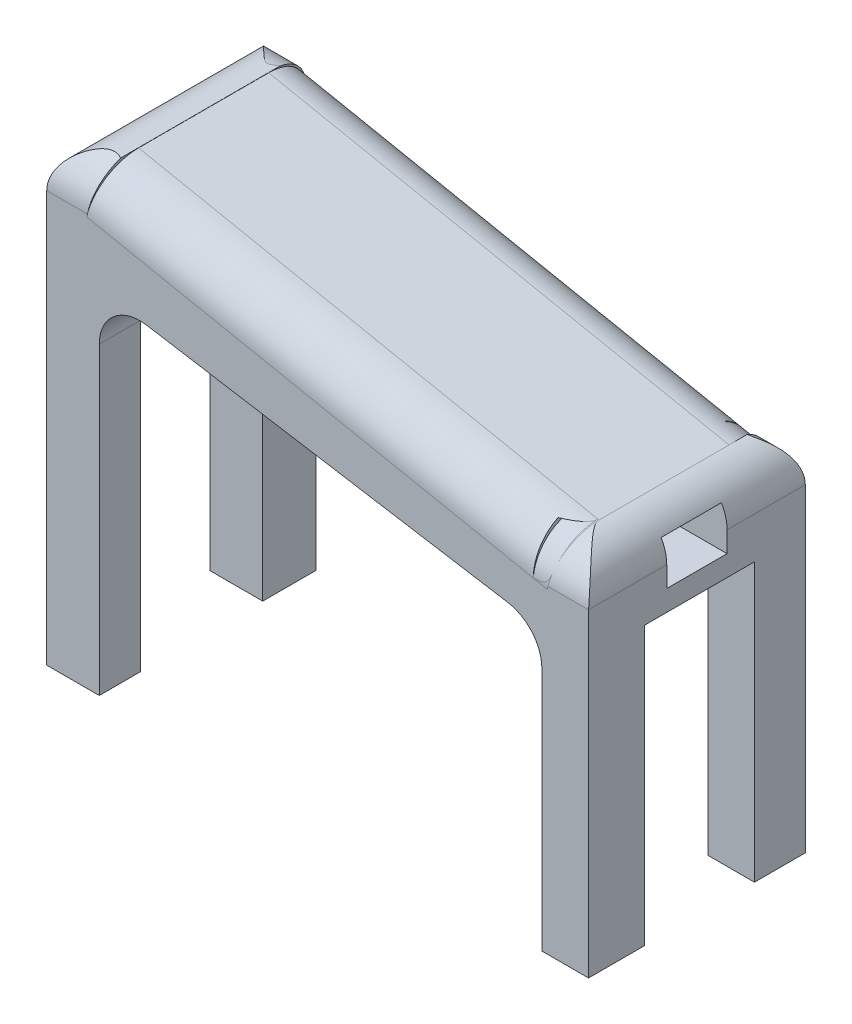
from build123d import *

# Parameters (mm, degrees)
SALIENTE_EXTRUIR1_DEPTH = 800
CROQUIS2_W              = 450.891954089
CROQUIS2_H              = 1153.204494417
CORTAR_EXTRUIR1_DEPTH   = 479
CROQUIS6_W              = 1733.666634621
CROQUIS6_H              = 800
CORTAR_EXTRUIR4_DEPTH   = 1
REDONDEO1_R             = 160
CORTAR_EXTRUIR5_DEPTH   = 204
CORTAR_EXTRUIR6_DEPTH   = 204
CROQUIS9_W              = 1543.706277585
CROQUIS9_H              = 195.894282261
CORTAR_EXTRUIR7_DEPTH   = 73
CROQUIS10_W             = 406.798125856
CROQUIS10_H             = 1024.288303457
CORTAR_EXTRUIR8_DEPTH   = 204
CROQUIS11_W             = 316.726975088
CROQUIS11_H             = 118.414803419
CORTAR_EXTRUIR9_DEPTH   = 204
CROQUIS13_W             = 222.696577042
CROQUIS13_H             = 152.562571667
CORTAR_EXTRUIR10_DEPTH  = 204


with BuildPart() as part:
    # Croquis1 → Saliente-Extruir1 (new body)
    with BuildSketch(Plane.XY):
        with BuildLine():
            Line((0, 0), (0, 1517.029414592))
            ThreePointArc((0, 1517.029414592), (54.901664159, 1633.030735793), (179.417420271, 1664.116515946))
            Line((179.417420271, 1664.116515946), (1879.417420271, 1324.116515946))
            ThreePointArc((1879.417420271, 1324.116515946), (1966.001321201, 1272.127750433), (2000, 1177.029414592))
            Line((2000, 1177.029414592), (2000, 0))
            Line((2000, 0), (1827.655470466, 0))
            Line((1827.655470466, 0), (1827.655470466, 903.590756555))
            ThreePointArc((1827.655470466, 903.590756555), (1792.016786618, 1000.655113392), (1702.035612225, 1051.596191212))
            Line((1702.035612225, 1051.596191212), (368.421499763, 1271.275294141))
            ThreePointArc((368.421499763, 1271.275294141), (246.977001167, 1237.631175636), (194.041358004, 1123.269859484))
            Line((194.041358004, 1123.269859484), (194.041358004, 0))
            Line((194.041358004, 0), (0, 0))
        make_face()
    extrude(amount=SALIENTE_EXTRUIR1_DEPTH)

    # Croquis2 → Cortar-Extruir1 (cut)
    with BuildSketch(Plane.ZY):
        with Locations((422.175014136, 576.602247208)):
            Rectangle(CROQUIS2_W, CROQUIS2_H)
    extrude(amount=-CORTAR_EXTRUIR1_DEPTH, mode=Mode.SUBTRACT)

    # Croquis6 → Cortar-Extruir4 (cut)
    with BuildSketch(Plane(origin=(326.923076923, 1634.615384615, 0), x_dir=(0.9805806756909202, -0.19611613513818404, 0), z_dir=(0.19611613513818404, 0.9805806756909202, 0))):
        with Locations((716.406472984, -400)):
            Rectangle(CROQUIS6_W, CROQUIS6_H)
    extrude(amount=-CORTAR_EXTRUIR4_DEPTH, mode=Mode.SUBTRACT)

    # Redondeo1
    redondeo1_edges = [part.edges().sort_by_distance(p)[0] for p in [
        (1029.221304136, 1493.13593527, 0),
        (1029.221304136, 1493.13593527, 800),
    ]]
    fillet(redondeo1_edges, radius=REDONDEO1_R)

    # Croquis7 → Cortar-Extruir5 (cut)
    with BuildSketch(Plane.ZY):
        with BuildLine():
            Line((0, 1517.029414592), (0, 1667.029414592))
            Line((0, 1667.029414592), (136.758196867, 1667.029414592))
            ThreePointArc((136.758196867, 1667.029414592), (39.321568117, 1618.521784269), (0, 1517.029414592))
        make_face()
        with BuildLine():
            ThreePointArc((800, 1517.029414592), (772.596251195, 1607.268062357), (699.64037564, 1667.029414592))
            Line((699.64037564, 1667.029414592), (800, 1667.029414592))
            Line((800, 1667.029414592), (800, 1517.029414592))
        make_face()
    extrude(amount=-CORTAR_EXTRUIR5_DEPTH, mode=Mode.SUBTRACT)

    # Croquis8 → Cortar-Extruir6 (cut)
    with BuildSketch(Plane(origin=(2000, 0, 0), x_dir=(0, 0, -1), z_dir=(1, 0, 0))):
        with BuildLine():
            ThreePointArc((-640, 1324.116515946), (-748.667630167, 1281.75735047), (-800, 1177.029414592))
            Line((-800, 1177.029414592), (-800, 1324.116515946))
            Line((-800, 1324.116515946), (-640, 1324.116515946))
        make_face()
        with BuildLine():
            ThreePointArc((0, 1177.029414592), (-25.457205923, 1264.264892498), (-93.837620587, 1324.116515946))
            Line((-93.837620587, 1324.116515946), (0, 1324.116515946))
            Line((0, 1324.116515946), (0, 1177.029414592))
        make_face()
    extrude(amount=-CORTAR_EXTRUIR6_DEPTH, mode=Mode.SUBTRACT)

    # Croquis9 → Cortar-Extruir7 (cut)
    with BuildSketch(Plane(origin=(297.309540517, 1486.547702586, 0), x_dir=(0.9805806756909202, -0.19611613513818407, 0), z_dir=(0.19611613513818407, 0.9805806756909202, 0))):
        with Locations((770.502378662, -401.181328028)):
            Rectangle(CROQUIS9_W, CROQUIS9_H)
    extrude(amount=-CORTAR_EXTRUIR7_DEPTH, mode=Mode.SUBTRACT)

    # Croquis10 → Cortar-Extruir8 (cut)
    with BuildSketch(Plane(origin=(2000, 0, 0), x_dir=(0, 0, -1), z_dir=(1, 0, 0))):
        with Locations((-391.027888744, 512.144151728)):
            Rectangle(CROQUIS10_W, CROQUIS10_H)
    extrude(amount=-CORTAR_EXTRUIR8_DEPTH, mode=Mode.SUBTRACT)

    # Croquis11 → Cortar-Extruir9 (cut)
    with BuildSketch(Plane.ZY):
        with Locations((420.951887064, 1550.388466328)):
            Rectangle(CROQUIS11_W, CROQUIS11_H)
    extrude(amount=-CORTAR_EXTRUIR9_DEPTH, mode=Mode.SUBTRACT)

    # Croquis13 → Cortar-Extruir10 (cut)
    with BuildSketch(Plane(origin=(2000, 0, 0), x_dir=(0, 0, -1), z_dir=(1, 0, 0))):
        with Locations((-400, 1177.029414592)):
            Rectangle(CROQUIS13_W, CROQUIS13_H)
    extrude(amount=-CORTAR_EXTRUIR10_DEPTH, mode=Mode.SUBTRACT)


solid = part.part
